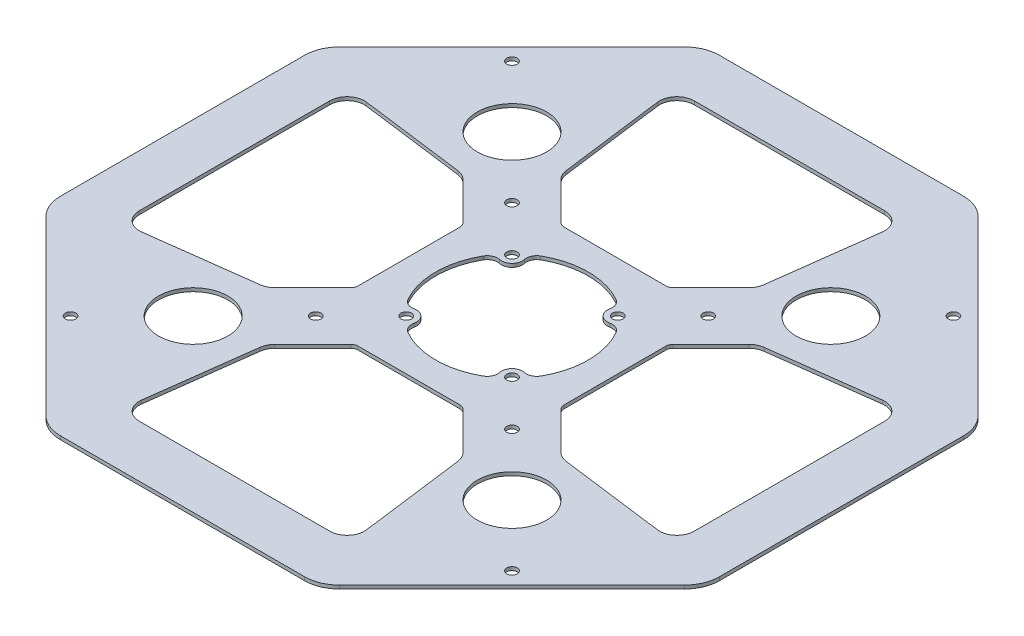
from build123d import *

# Parameters (mm, degrees)
SKETCH1_R           = 1.5
SKETCH1_R_2         = 10
BOSS_EXTRUDE1_DEPTH = 1


with BuildPart() as part:
    # Sketch1 → Boss-Extrude1 (new body)
    with BuildSketch(Plane(origin=(0, 0, 0), x_dir=(1, 0, 0), z_dir=(0, 1, 0))):
        with BuildLine():
            Line((92.071067812, 42.279220614), (42.279220614, 92.071067812))
            ThreePointArc((42.279220614, 92.071067812), (39.034987125, 94.238795325), (35.208152802, 95))
            Line((35.208152802, 95), (-35.208152802, 95))
            ThreePointArc((-35.208152802, 95), (-39.034987125, 94.238795325), (-42.279220614, 92.071067812))
            Line((-42.279220614, 92.071067812), (-92.071067812, 42.279220614))
            ThreePointArc((-92.071067812, 42.279220614), (-94.238795325, 39.034987125), (-95, 35.208152802))
            Line((-95, 35.208152802), (-95, -35.208152802))
            ThreePointArc((-95, -35.208152802), (-94.238795325, -39.034987125), (-92.071067812, -42.279220614))
            Line((-92.071067812, -42.279220614), (-42.279220614, -92.071067812))
            ThreePointArc((-42.279220614, -92.071067812), (-39.034987125, -94.238795325), (-35.208152802, -95))
            Line((-35.208152802, -95), (35.208152802, -95))
            ThreePointArc((35.208152802, -95), (39.034987125, -94.238795325), (42.279220614, -92.071067812))
            Line((42.279220614, -92.071067812), (92.071067812, -42.279220614))
            ThreePointArc((92.071067812, -42.279220614), (94.238795325, -39.034987125), (95, -35.208152802))
            Line((95, -35.208152802), (95, 35.208152802))
            ThreePointArc((95, 35.208152802), (94.238795325, 39.034987125), (92.071067812, 42.279220614))
        make_face()
        with Locations(Location((63.639610307, 63.639610307, 0), (0, 0, 270))):
            Circle(SKETCH1_R, mode=Mode.SUBTRACT)
        with Locations(Location((28.284271247, 28.284271247, 0), (0, 0, 270))):
            Circle(SKETCH1_R, mode=Mode.SUBTRACT)
        with Locations(Location((63.639610307, -63.639610307, 0), (0, 0, 270))):
            Circle(SKETCH1_R, mode=Mode.SUBTRACT)
        with Locations(Location((28.284271247, -28.284271247, 0), (0, 0, 270))):
            Circle(SKETCH1_R, mode=Mode.SUBTRACT)
        with Locations(Location((-63.639610307, -63.639610307, 0), (0, 0, 270))):
            Circle(SKETCH1_R, mode=Mode.SUBTRACT)
        with Locations(Location((-28.284271247, -28.284271247, 0), (0, 0, 270))):
            Circle(SKETCH1_R, mode=Mode.SUBTRACT)
        with Locations(Location((-63.639610307, 63.639610307, 0), (0, 0, 270))):
            Circle(SKETCH1_R, mode=Mode.SUBTRACT)
        with Locations(Location((-28.284271247, 28.284271247, 0), (0, 0, 270))):
            Circle(SKETCH1_R, mode=Mode.SUBTRACT)
        with Locations(Location((-45.961940777, 45.961940777, 0), (0, 0, 270))):
            Circle(SKETCH1_R_2, mode=Mode.SUBTRACT)
        with Locations(Location((45.961940777, 45.961940777, 0), (0, 0, 270))):
            Circle(SKETCH1_R_2, mode=Mode.SUBTRACT)
        with Locations(Location((45.961940777, -45.961940777, 0), (0, 0, 270))):
            Circle(SKETCH1_R_2, mode=Mode.SUBTRACT)
        with Locations(Location((-45.961940777, -45.961940777, 0), (0, 0, 270))):
            Circle(SKETCH1_R_2, mode=Mode.SUBTRACT)
        with Locations(Location((15.25, 15.25, 0), (0, 0, 270))):
            Circle(SKETCH1_R, mode=Mode.SUBTRACT)
        with Locations(Location((15.25, -15.25, 0), (0, 0, 270))):
            Circle(SKETCH1_R, mode=Mode.SUBTRACT)
        with Locations(Location((-15.25, -15.25, 0), (0, 0, 270))):
            Circle(SKETCH1_R, mode=Mode.SUBTRACT)
        with Locations(Location((-15.25, 15.25, 0), (0, 0, 270))):
            Circle(SKETCH1_R, mode=Mode.SUBTRACT)
        with BuildLine():
            Line((27.079275596, 41.221411219), (16.142135624, 30.284271247))
            ThreePointArc((16.142135624, 30.284271247), (15.493288926, 29.850725745), (14.727922061, 29.69848481))
            Line((14.727922061, 29.69848481), (-14.727922061, 29.69848481))
            ThreePointArc((-14.727922061, 29.69848481), (-15.493288926, 29.850725745), (-16.142135624, 30.284271247))
            Line((-16.142135624, 30.284271247), (-27.079275596, 41.221411219))
            ThreePointArc((-27.079275596, 41.221411219), (-28.030817483, 42.551009763), (-28.502553799, 44.116490233))
            Line((-28.502553799, 44.116490233), (-32.40859259, 74.359545108))
            ThreePointArc((-32.40859259, 74.359545108), (-31.204928579, 78.301342571), (-27.449780482, 80))
            Line((-27.449780482, 80), (27.449780482, 80))
            ThreePointArc((27.449780482, 80), (31.204928579, 78.301342571), (32.40859259, 74.359545108))
            Line((32.40859259, 74.359545108), (28.502553799, 44.116490233))
            ThreePointArc((28.502553799, 44.116490233), (28.030817483, 42.551009763), (27.079275596, 41.221411219))
        make_face(mode=Mode.SUBTRACT)
        with BuildLine():
            Line((30.284271247, 16.142135624), (41.221411219, 27.079275596))
            ThreePointArc((41.221411219, 27.079275596), (42.551009763, 28.030817483), (44.116490233, 28.502553799))
            Line((44.116490233, 28.502553799), (74.359545108, 32.40859259))
            ThreePointArc((74.359545108, 32.40859259), (78.301342571, 31.204928579), (80, 27.449780482))
            Line((80, 27.449780482), (80, -27.449780482))
            ThreePointArc((80, -27.449780482), (78.301342571, -31.204928579), (74.359545108, -32.40859259))
            Line((74.359545108, -32.40859259), (44.116490233, -28.502553799))
            ThreePointArc((44.116490233, -28.502553799), (42.551009763, -28.030817483), (41.221411219, -27.079275596))
            Line((41.221411219, -27.079275596), (30.284271247, -16.142135624))
            ThreePointArc((30.284271247, -16.142135624), (29.850725745, -15.493288926), (29.69848481, -14.727922061))
            Line((29.69848481, -14.727922061), (29.69848481, 14.727922061))
            ThreePointArc((29.69848481, 14.727922061), (29.850725745, 15.493288926), (30.284271247, 16.142135624))
        make_face(mode=Mode.SUBTRACT)
        with BuildLine():
            Line((16.142135624, -30.284271247), (27.079275596, -41.221411219))
            ThreePointArc((27.079275596, -41.221411219), (28.030817483, -42.551009763), (28.502553799, -44.116490233))
            Line((28.502553799, -44.116490233), (32.40859259, -74.359545108))
            ThreePointArc((32.40859259, -74.359545108), (31.204928579, -78.301342571), (27.449780482, -80))
            Line((27.449780482, -80), (-27.449780482, -80))
            ThreePointArc((-27.449780482, -80), (-31.204928579, -78.301342571), (-32.40859259, -74.359545108))
            Line((-32.40859259, -74.359545108), (-28.502553799, -44.116490233))
            ThreePointArc((-28.502553799, -44.116490233), (-28.030817483, -42.551009763), (-27.079275596, -41.221411219))
            Line((-27.079275596, -41.221411219), (-16.142135624, -30.284271247))
            ThreePointArc((-16.142135624, -30.284271247), (-15.493288926, -29.850725745), (-14.727922061, -29.69848481))
            Line((-14.727922061, -29.69848481), (14.727922061, -29.69848481))
            ThreePointArc((14.727922061, -29.69848481), (15.493288926, -29.850725745), (16.142135624, -30.284271247))
        make_face(mode=Mode.SUBTRACT)
        with BuildLine():
            Line((-30.284271247, -16.142135624), (-41.221411219, -27.079275596))
            ThreePointArc((-41.221411219, -27.079275596), (-42.551009763, -28.030817483), (-44.116490233, -28.502553799))
            Line((-44.116490233, -28.502553799), (-74.359545108, -32.40859259))
            ThreePointArc((-74.359545108, -32.40859259), (-78.301342571, -31.204928579), (-80, -27.449780482))
            Line((-80, -27.449780482), (-80, 27.449780482))
            ThreePointArc((-80, 27.449780482), (-78.301342571, 31.204928579), (-74.359545108, 32.40859259))
            Line((-74.359545108, 32.40859259), (-44.116490233, 28.502553799))
            ThreePointArc((-44.116490233, 28.502553799), (-42.551009763, 28.030817483), (-41.221411219, 27.079275596))
            Line((-41.221411219, 27.079275596), (-30.284271247, 16.142135624))
            ThreePointArc((-30.284271247, 16.142135624), (-29.850725745, 15.493288926), (-29.69848481, 14.727922061))
            Line((-29.69848481, 14.727922061), (-29.69848481, -14.727922061))
            ThreePointArc((-29.69848481, -14.727922061), (-29.850725745, -15.493288926), (-30.284271247, -16.142135624))
        make_face(mode=Mode.SUBTRACT)
        with BuildLine():
            ThreePointArc((22, 0), (21.269941811, -5.620460422), (19.128220423, -10.86789692))
            ThreePointArc((19.128220423, -10.86789692), (17.744295436, -12.124647251), (15.884913364, -12.317955488))
            ThreePointArc((15.884913364, -12.317955488), (13.128679656, -13.128679656), (12.317955488, -15.884913364))
            ThreePointArc((12.317955488, -15.884913364), (12.124647251, -17.744295436), (10.86789692, -19.128220423))
            ThreePointArc((10.86789692, -19.128220423), (5.620460422, -21.269941811), (0, -22))
            ThreePointArc((0, -22), (-5.620460422, -21.269941811), (-10.86789692, -19.128220423))
            ThreePointArc((-10.86789692, -19.128220423), (-12.124647251, -17.744295436), (-12.317955488, -15.884913364))
            ThreePointArc((-12.317955488, -15.884913364), (-13.128679656, -13.128679656), (-15.884913364, -12.317955488))
            ThreePointArc((-15.884913364, -12.317955488), (-17.744295436, -12.124647251), (-19.128220423, -10.86789692))
            ThreePointArc((-19.128220423, -10.86789692), (-21.269941811, -5.620460422), (-22, 0))
            ThreePointArc((-22, 0), (-21.269941811, 5.620460422), (-19.128220423, 10.86789692))
            ThreePointArc((-19.128220423, 10.86789692), (-17.744295436, 12.124647251), (-15.884913364, 12.317955488))
            ThreePointArc((-15.884913364, 12.317955488), (-13.128679656, 13.128679656), (-12.317955488, 15.884913364))
            ThreePointArc((-12.317955488, 15.884913364), (-12.124647251, 17.744295436), (-10.86789692, 19.128220423))
            ThreePointArc((-10.86789692, 19.128220423), (-5.620460422, 21.269941811), (0, 22))
            ThreePointArc((0, 22), (5.620460422, 21.269941811), (10.86789692, 19.128220423))
            ThreePointArc((10.86789692, 19.128220423), (12.124647251, 17.744295436), (12.317955488, 15.884913364))
            ThreePointArc((12.317955488, 15.884913364), (13.128679656, 13.128679656), (15.884913364, 12.317955488))
            ThreePointArc((15.884913364, 12.317955488), (17.744295436, 12.124647251), (19.128220423, 10.86789692))
            ThreePointArc((19.128220423, 10.86789692), (21.269941811, 5.620460422), (22, 0))
        make_face(mode=Mode.SUBTRACT)
    extrude(amount=BOSS_EXTRUDE1_DEPTH)


solid = part.part
